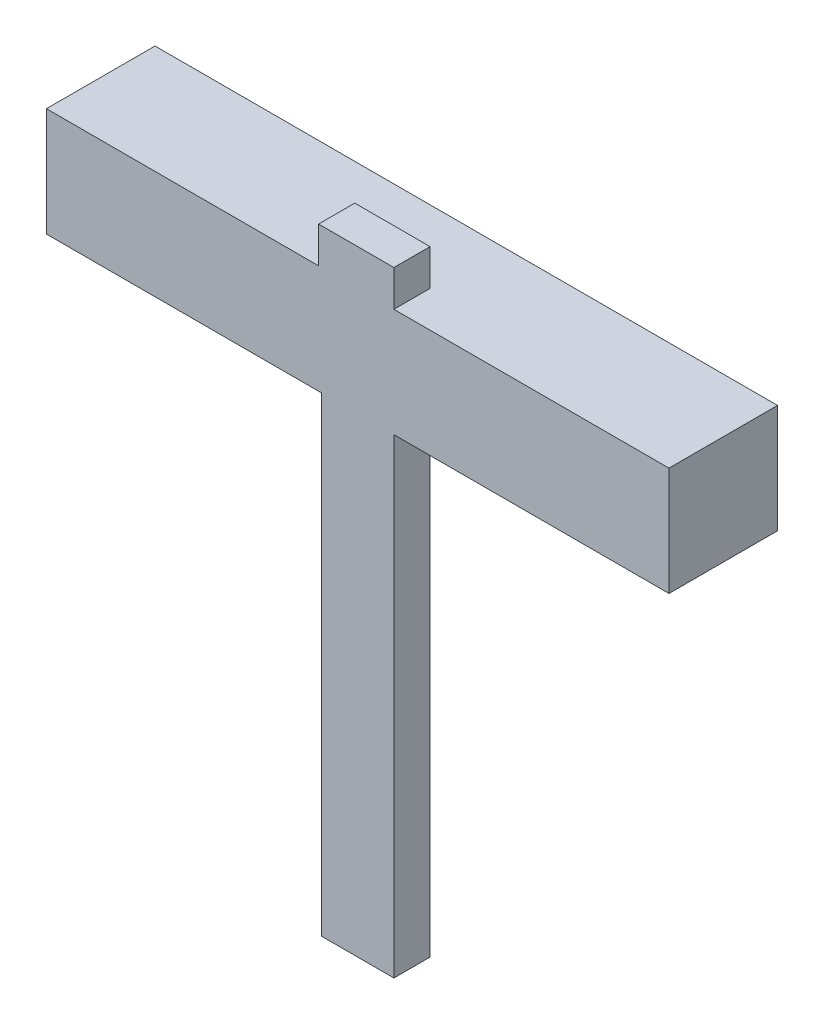
from build123d import *

# Parameters (mm, degrees)
BOSS_EXTRUDE1_DEPTH = 5
SKETCH2_W           = 80
SKETCH2_H           = 15
BOSS_EXTRUDE2_DEPTH = 5
SKETCH3_W           = 15
SKETCH3_H           = 15
BOSS_EXTRUDE3_DEPTH = 3
SKETCH4_W           = 15
SKETCH4_H           = 15
BOSS_EXTRUDE4_DEPTH = 3
SKETCH5_W           = 0.08
SKETCH5_H           = 10
CUT_EXTRUDE1_DEPTH  = 10
SKETCH6_W           = 10.40455395
SKETCH6_H           = 5
BOSS_EXTRUDE5_DEPTH = 5


with BuildPart() as part:
    # Sketch1 → Boss-Extrude1 (new body)
    with BuildSketch(Plane.XY):
        Polygon((-40, 10), (40, 10), (40, 0), (5, 0), (5, -65), (-5, -65), (-5, 0), (-40, 0), align=None)
    extrude(amount=BOSS_EXTRUDE1_DEPTH)

    # Sketch2 → Boss-Extrude2 (add)
    with BuildSketch(Plane(origin=(0, 10, 0), x_dir=(1, 0, 0), z_dir=(0, 1, 0))):
        with Locations((0, 2.5)):
            Rectangle(SKETCH2_W, SKETCH2_H)
    extrude(amount=BOSS_EXTRUDE2_DEPTH)

    # Sketch3 → Boss-Extrude3 (add)
    with BuildSketch(Plane(origin=(40, 0, 0), x_dir=(0, 0, -1), z_dir=(1, 0, 0))):
        with Locations((2.5, 7.5)):
            Rectangle(SKETCH3_W, SKETCH3_H)
    extrude(amount=BOSS_EXTRUDE3_DEPTH)

    # Sketch4 → Boss-Extrude4 (add)
    with BuildSketch(Plane.ZY.offset(40)):
        with Locations((-2.5, 7.5)):
            Rectangle(SKETCH4_W, SKETCH4_H)
    extrude(amount=BOSS_EXTRUDE4_DEPTH)

    # Sketch5 → Cut-Extrude1 (cut)
    with BuildSketch(Plane.XZ):
        with Locations((-40.04, -5)):
            Rectangle(SKETCH5_W, SKETCH5_H)
        with Locations((40.04, -5)):
            Rectangle(SKETCH5_W, SKETCH5_H)
    extrude(amount=-CUT_EXTRUDE1_DEPTH, mode=Mode.SUBTRACT)

    # Sketch6 → Boss-Extrude5 (add)
    with BuildSketch(Plane(origin=(0, 15, 0), x_dir=(1, 0, 0), z_dir=(0, 1, 0))):
        with Locations((-0.202276975, -2.5)):
            Rectangle(SKETCH6_W, SKETCH6_H)
    extrude(amount=BOSS_EXTRUDE5_DEPTH)


solid = part.part
